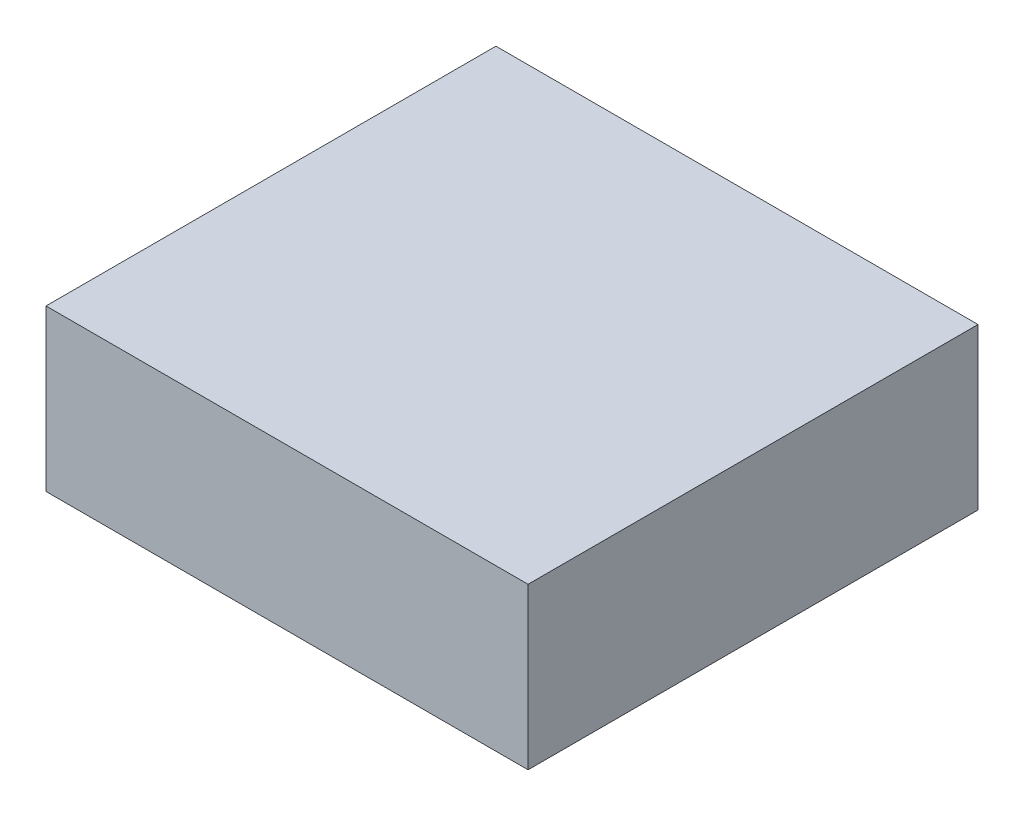
from build123d import *

# Parameters (mm, degrees)
CROQUIS1_W              = 60
CROQUIS1_H              = 56
SALIENTE_EXTRUIR1_DEPTH = 20


with BuildPart() as part:
    # Croquis1 → Saliente-Extruir1 (new body)
    with BuildSketch(Plane(origin=(0, 0, 0), x_dir=(1, 0, 0), z_dir=(0, 1, 0))):
        Rectangle(CROQUIS1_W, CROQUIS1_H)
    extrude(amount=SALIENTE_EXTRUIR1_DEPTH)


solid = part.part
